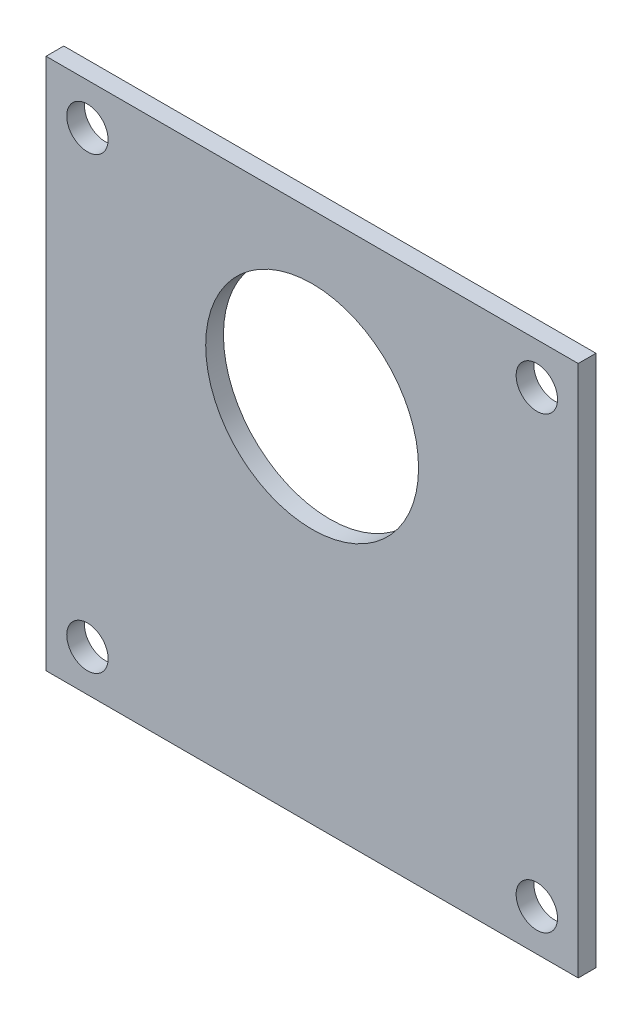
from build123d import *

# Parameters (mm, degrees)
SKETCH1_W           = 45
SKETCH1_H           = 45
BOSS_EXTRUDE1_DEPTH = 1.5
SKETCH2_R           = 1.75
SKETCH2_R_2         = 9
CUT_EXTRUDE1_DEPTH  = 32.855140872


with BuildPart() as part:
    # Sketch1 → Boss-Extrude1 (new body)
    with BuildSketch(Plane.XY):
        Rectangle(SKETCH1_W, SKETCH1_H)
    extrude(amount=BOSS_EXTRUDE1_DEPTH)

    # Sketch2 → Cut-Extrude1 (cut, through all)
    with BuildSketch(Plane.XY.offset(1.5)):
        with Locations((-19, 19)):
            Circle(SKETCH2_R)
        with Locations(Location((19, -19, 0), (0, 0, 180))):
            Circle(SKETCH2_R)
        with Locations((19, 19)):
            Circle(SKETCH2_R)
        with Locations(Location((-19, -19, 0), (0, 0, 180))):
            Circle(SKETCH2_R)
        with Locations((0, 8.1)):
            Circle(SKETCH2_R_2)
    extrude(amount=-CUT_EXTRUDE1_DEPTH, mode=Mode.SUBTRACT)


solid = part.part
